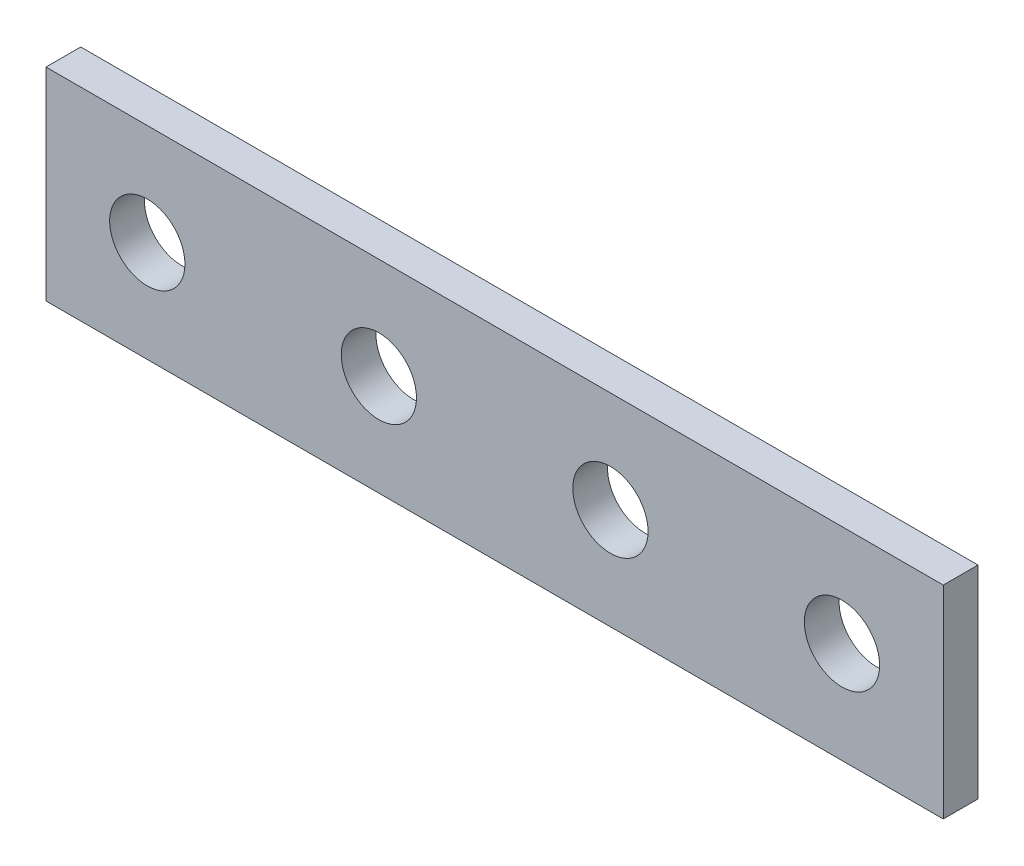
from build123d import *

# Parameters (mm, degrees)
SKETCH_1_W      = 310
SKETCH_1_H      = 70
SKETCH_1_R      = 13
EXTRUDE_1_DEPTH = 12


with BuildPart() as part:
    # 草图1 → 凸台-拉伸1 (new body)
    with BuildSketch(Plane.XY):
        with Locations((155, 35)):
            Rectangle(SKETCH_1_W, SKETCH_1_H)
        with Locations((35, 35)):
            Circle(SKETCH_1_R, mode=Mode.SUBTRACT)
        with Locations((115, 35)):
            Circle(SKETCH_1_R, mode=Mode.SUBTRACT)
        with Locations((195, 35)):
            Circle(SKETCH_1_R, mode=Mode.SUBTRACT)
        with Locations((275, 35)):
            Circle(SKETCH_1_R, mode=Mode.SUBTRACT)
    extrude(amount=EXTRUDE_1_DEPTH)


solid = part.part
